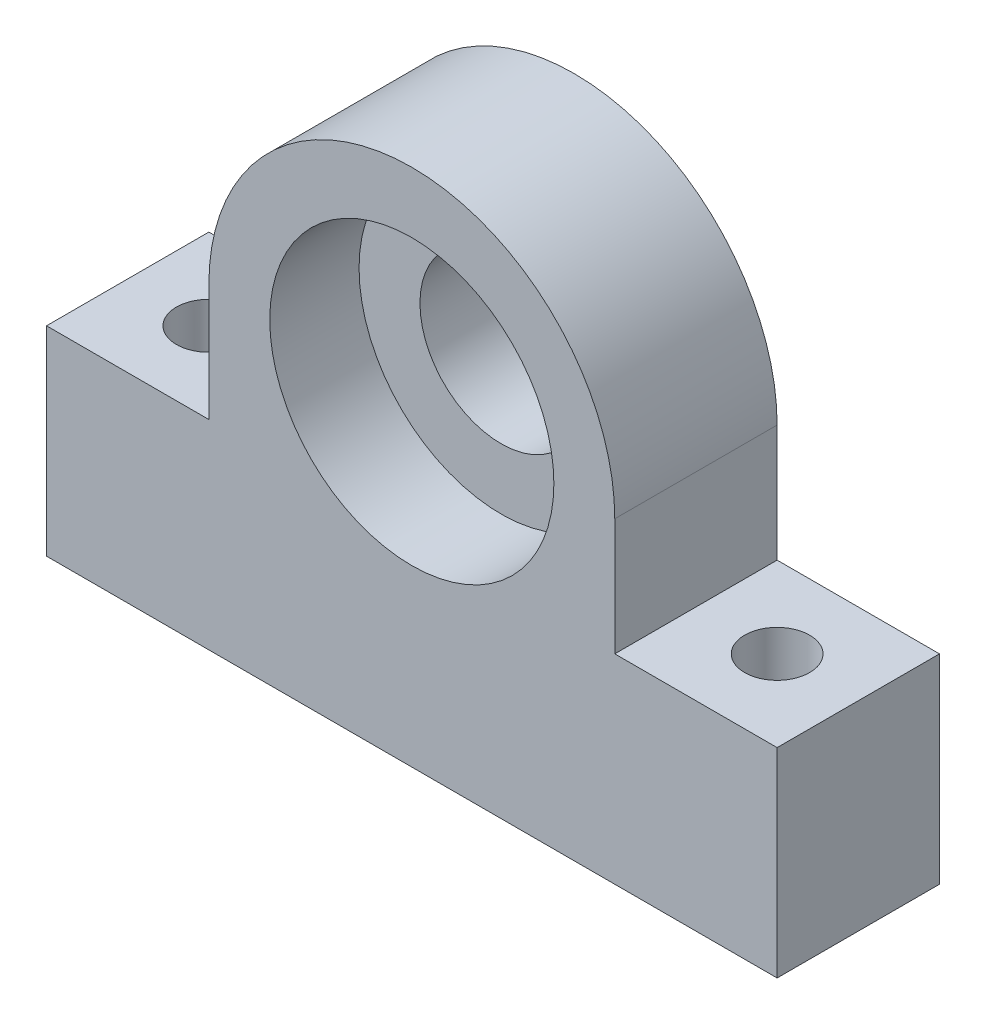
from build123d import *

# Parameters (mm, degrees)
SKETCH1_R           = 25
SKETCH1_R_2         = 17.5
BOSS_EXTRUDE1_DEPTH = 20
BOSS_EXTRUDE2_START = -20
BOSS_EXTRUDE2_DEPTH = 20
SKETCH3_R           = 20
SKETCH3_R_2         = 10
BOSS_EXTRUDE3_DEPTH = 9
SKETCH4_R           = 4
CUT_EXTRUDE1_DEPTH  = 30


with BuildPart() as part:
    # Sketch1 → Boss-Extrude1 (new body)
    with BuildSketch(Plane.XY):
        Circle(SKETCH1_R)
        Circle(SKETCH1_R_2, mode=Mode.SUBTRACT)
    extrude(amount=BOSS_EXTRUDE1_DEPTH)

    # Sketch2 → Boss-Extrude2 (add)
    with BuildSketch(Plane.XY.offset(20).offset(BOSS_EXTRUDE2_START)):
        with BuildLine():
            Line((25, 0), (25, -14.411258269))
            Line((25, -14.411258269), (45, -14.411258269))
            Line((45, -14.411258269), (45, -38.991258269))
            Line((45, -38.991258269), (-45, -38.991258269))
            Line((-45, -38.991258269), (-45, -14.411258269))
            Line((-45, -14.411258269), (-25, -14.411258269))
            Line((-25, -14.411258269), (-25, 0))
            ThreePointArc((-25, 0), (0, -25), (25, 0))
        make_face()
    extrude(amount=BOSS_EXTRUDE2_DEPTH)

    # Sketch3 → Boss-Extrude3 (add)
    with BuildSketch(Plane(origin=(0, 0, 0), x_dir=(-1, 0, 0), z_dir=(0, 0, -1))):
        Circle(SKETCH3_R)
        Circle(SKETCH3_R_2, mode=Mode.SUBTRACT)
    extrude(amount=-BOSS_EXTRUDE3_DEPTH)

    # Sketch4 → Cut-Extrude1 (cut)
    with BuildSketch(Plane(origin=(0, -14.411258269, 0), x_dir=(1, 0, 0), z_dir=(0, 1, 0))):
        with Locations(Location((35, -10, 0), (0, 0, 270))):
            Circle(SKETCH4_R)
        with Locations((-35, -10)):
            Circle(SKETCH4_R)
    extrude(amount=-CUT_EXTRUDE1_DEPTH, mode=Mode.SUBTRACT)


solid = part.part
